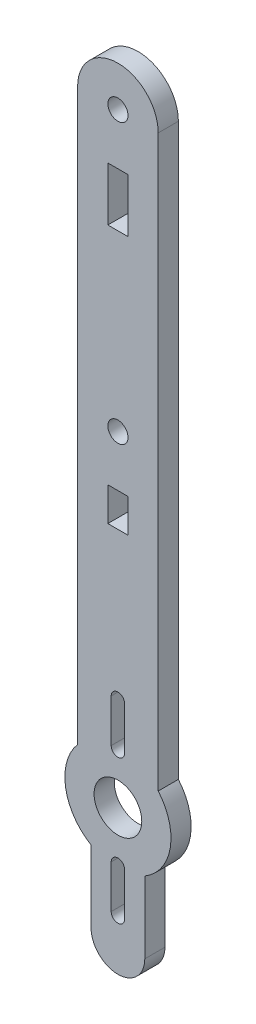
from build123d import *

# Parameters (mm, degrees)
SKETCH1_R           = 3.55
SKETCH1_W           = 3
SKETCH1_H           = 5
SKETCH1_H_2         = 8
SKETCH1_R_2         = 1.5
BOSS_EXTRUDE1_DEPTH = 3


with BuildPart() as part:
    # Sketch1 → Boss-Extrude1 (new body)
    with BuildSketch(Plane.XY):
        with BuildLine():
            ThreePointArc((6, 90), (0, 96), (-6, 90))
            Line((-6, 90), (-6, 5.139066063))
            ThreePointArc((-6, 5.139066063), (-7.791656712, -1.303873341), (-4, -6.812488532))
            Line((-4, -6.812488532), (-4, -17.5))
            ThreePointArc((-4, -17.5), (0, -21.5), (4, -17.5))
            Line((4, -17.5), (4, -6.812488532))
            ThreePointArc((4, -6.812488532), (7.791656712, -1.303873341), (6, 5.139066063))
            Line((6, 5.139066063), (6, 90))
        make_face()
        with BuildLine():
            ThreePointArc((-1, -7.5), (0, -6.5), (1, -7.5))
            Line((1, -7.5), (1, -13.9))
            ThreePointArc((1, -13.9), (0, -14.9), (-1, -13.9))
            Line((-1, -13.9), (-1, -7.5))
        make_face(mode=Mode.SUBTRACT)
        Circle(SKETCH1_R, mode=Mode.SUBTRACT)
        with BuildLine():
            Line((1, 13.9), (1, 7.5))
            ThreePointArc((1, 7.5), (0, 6.5), (-1, 7.5))
            Line((-1, 7.5), (-1, 13.9))
            ThreePointArc((-1, 13.9), (0, 14.9), (1, 13.9))
        make_face(mode=Mode.SUBTRACT)
        with Locations((0, 38.376985236)):
            Rectangle(SKETCH1_W, SKETCH1_H, mode=Mode.SUBTRACT)
        with BuildLine():
            ThreePointArc((1.060660172, 47.416325064), (-1.060660172, 47.416325064), (-1.060660172, 49.537645408))
            ThreePointArc((-1.060660172, 49.537645408), (0.574025149, 49.862804535), (1.5, 48.476985236))
            ThreePointArc((1.5, 48.476985236), (1.385819299, 47.902960087), (1.060660172, 47.416325064))
        make_face(mode=Mode.SUBTRACT)
        with Locations((0, 78.376985236)):
            Rectangle(SKETCH1_W, SKETCH1_H_2, mode=Mode.SUBTRACT)
        with Locations((0, 90)):
            Circle(SKETCH1_R_2, mode=Mode.SUBTRACT)
    extrude(amount=BOSS_EXTRUDE1_DEPTH)


solid = part.part
